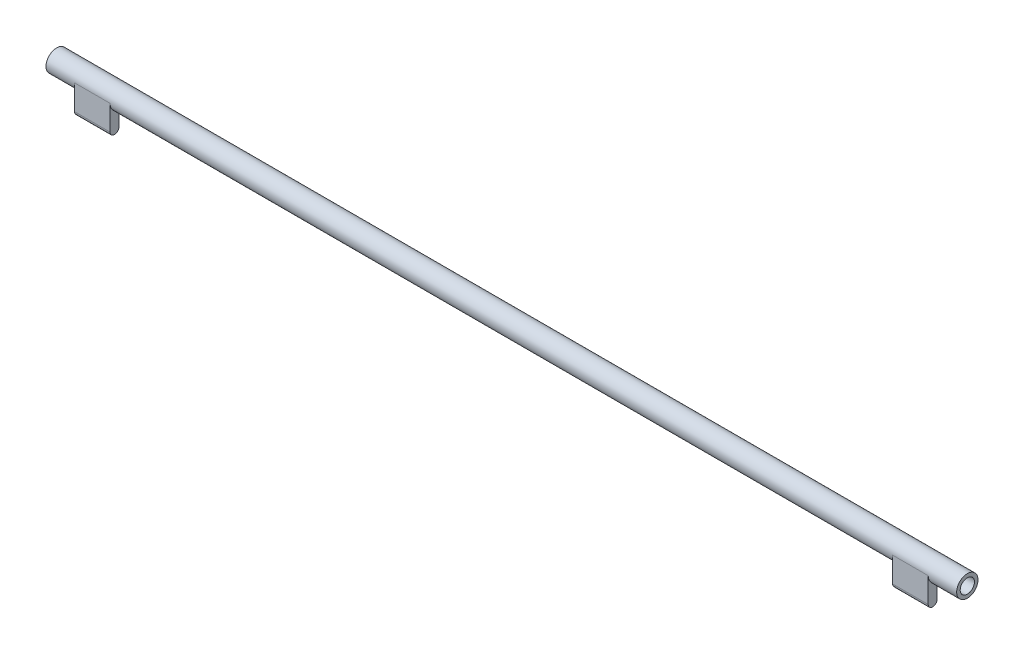
from build123d import *

# Parameters (mm, degrees)
SKETCH_1_R      = 3
SKETCH_1_R_2    = 2
EXTRUDE_1_DEPTH = 128
EXTRUDE_START   = 10
EXTRUDE_2_DEPTH = 10


with BuildPart() as part:
    # 草圖1 → 填料-伸長1 (new, symmetric)
    with BuildSketch(Plane(origin=(0, 0, 0), x_dir=(0, 0, -1), z_dir=(1, 0, 0))):
        Circle(SKETCH_1_R)
        Circle(SKETCH_1_R_2, mode=Mode.SUBTRACT)
    extrude(amount=EXTRUDE_1_DEPTH, both=True)

    # 草圖2 → 填料-伸長2 (add)
    with BuildSketch(Plane(origin=(110, 0, 0), x_dir=(0, 0, -1), z_dir=(1, 0, 0)).offset(EXTRUDE_START)):
        with BuildLine():
            Line((-3, 0), (-3, -7))
            ThreePointArc((-3, -7), (-1.75, -8.25), (-0.5, -7))
            Line((-0.5, -7), (-0.5, -2.958039892))
            ThreePointArc((-0.5, -2.958039892), (-2.291287847, -1.936491673), (-3, 0))
        make_face()
    extrude_2 = extrude(amount=-EXTRUDE_2_DEPTH)

    # 鏡射1: 填料-伸長2 across plane
    add(extrude_2.mirror(Plane(origin=(0, 0, 0), x_dir=(0, 0, 1), z_dir=(1, 0, 0))))


solid = part.part
